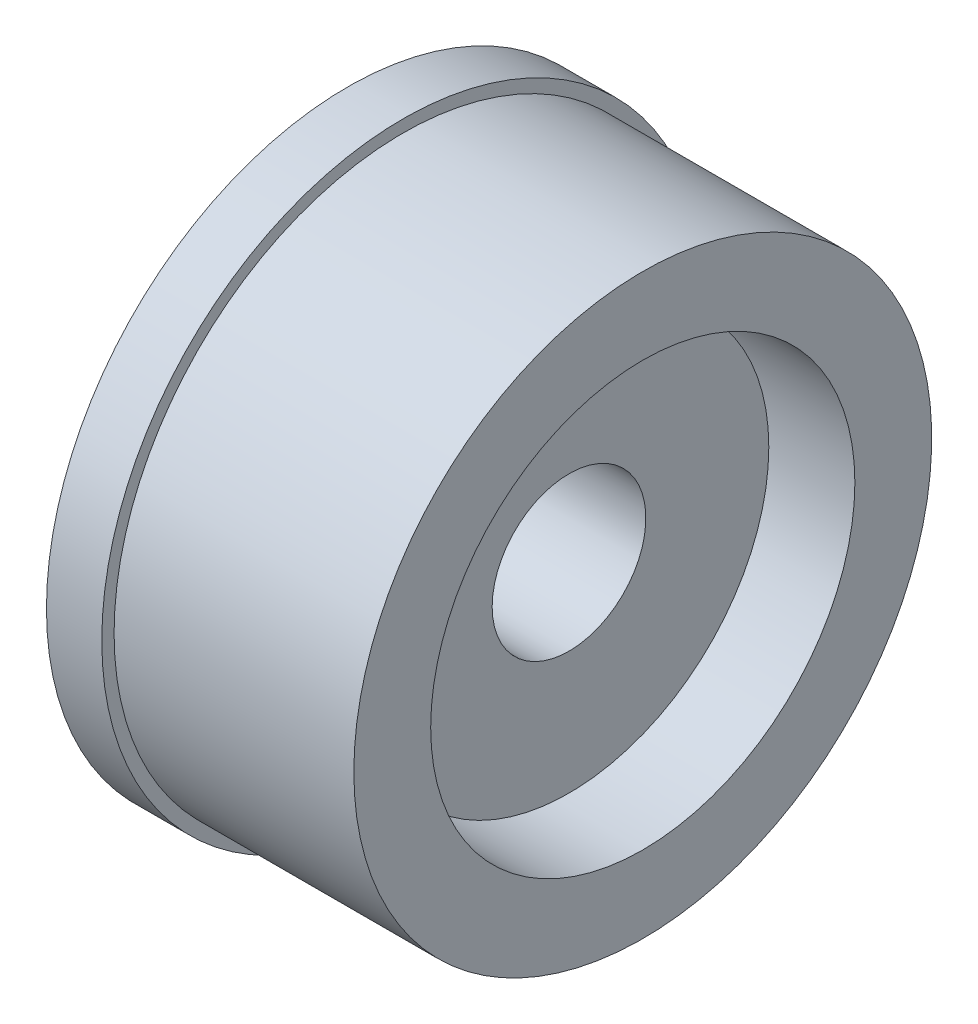
from build123d import *


with BuildPart() as part:
    # Çizim1 → Döndür1 (revolve)
    with BuildSketch(Plane.XY, mode=Mode.PRIVATE) as d_nd_r1_sk:
        Polygon((0, 6.25), (21, 6.25), (21, 16.25), (3, 16.25), (0, 10.25), align=None)
        Polygon((7.5, 24.5), (7.5, 23.5), (27, 23.5), (27, 17.25), (3, 17.25), (3, 24.5), align=None)
    revolve(d_nd_r1_sk.sketch.rotate(Axis((0, 0, 0), (1, 0, 0)), 90), axis=Axis((0, 0, 0), (1, 0, 0)))


solid = part.part
